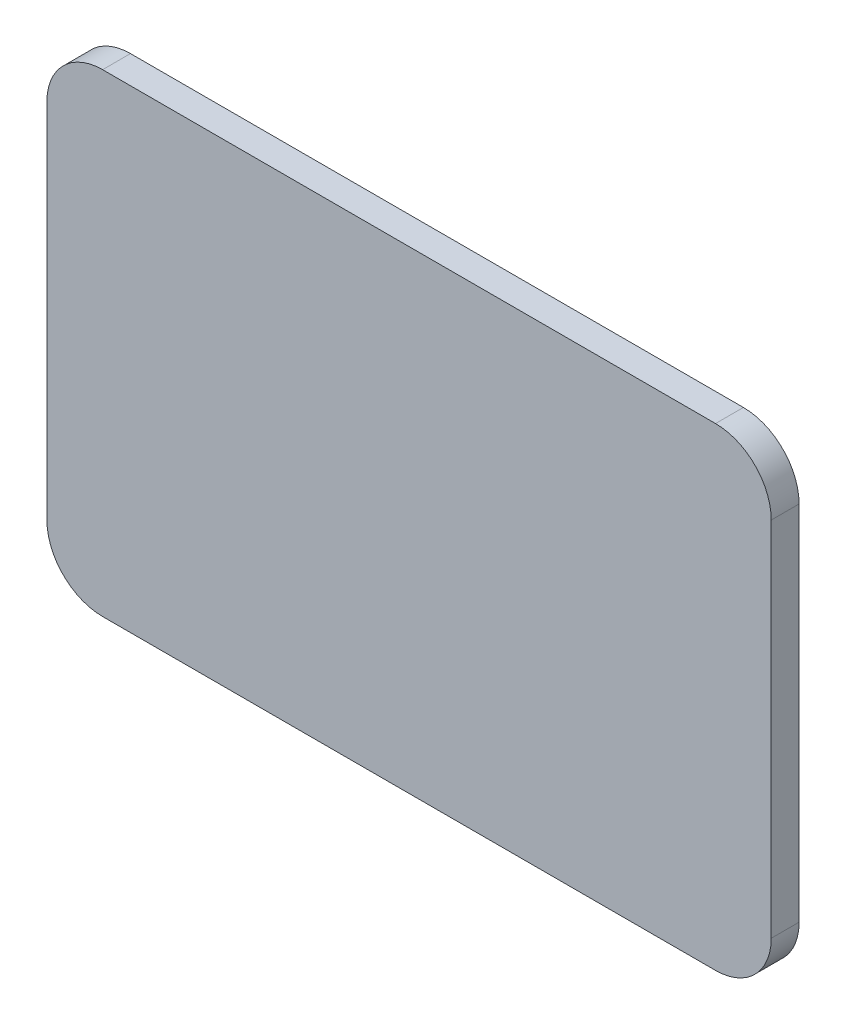
from build123d import *

# Parameters (mm, degrees)
SKETCH_1_W         = 26
SKETCH_1_H         = 17
BLOCKEXTRUDE_DEPTH = 1
FILLET_2_R         = 2


with BuildPart() as part:
    # 草图1 → BlockExtrude (new body)
    with BuildSketch(Plane.XY):
        with Locations((13, 8.5)):
            Rectangle(SKETCH_1_W, SKETCH_1_H)
    extrude(amount=BLOCKEXTRUDE_DEPTH)

    # Fillet 2
    fillet_2_edges = [part.edges().sort_by_distance(p)[0] for p in [
        (0, 17, 0.5),
        (26, 17, 0.5),
        (26, 0, 0.5),
        (0, 0, 0.5),
    ]]
    fillet(fillet_2_edges, radius=FILLET_2_R)


solid = part.part
